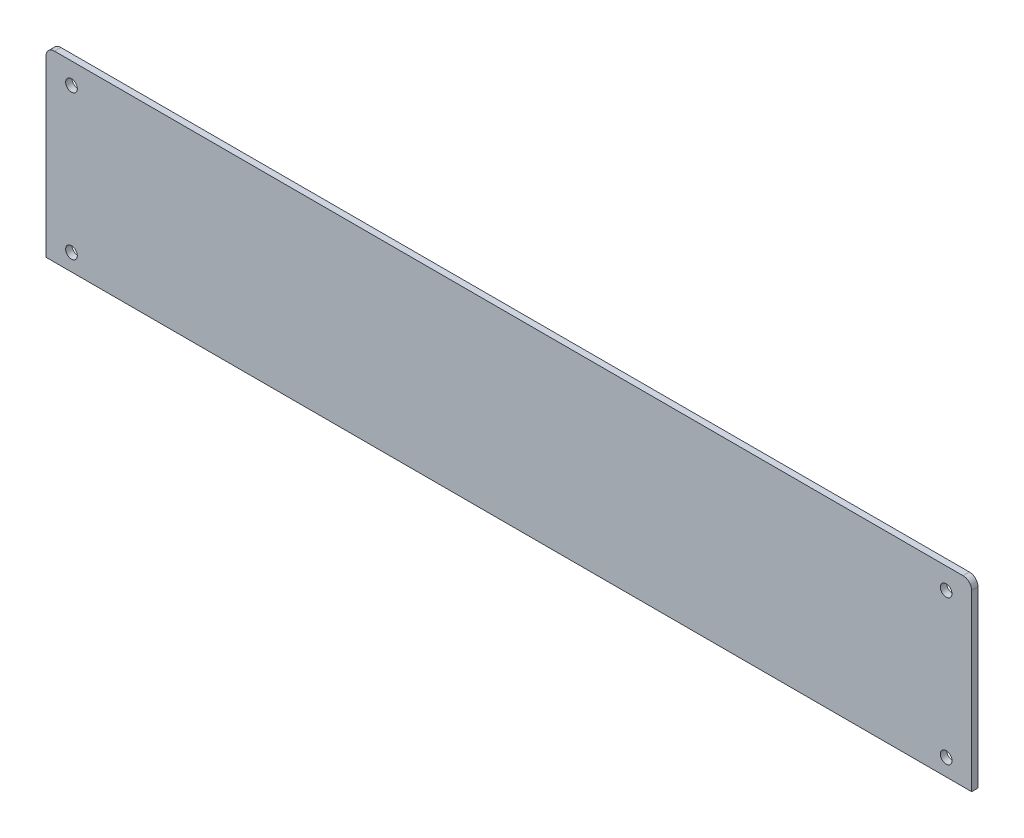
from build123d import *

# Parameters (mm, degrees)
SKETCH_1_W          = 436
SKETCH_1_H          = 86.1
EXTRUDE_1_DEPTH     = 3
SKETCH_6_R          = 2.75
CUT_EXTRUDE_1_DEPTH = 445.430208244
FILLET_1_R          = 4


with BuildPart() as part:
    # Эскиз1 → Бобышка-Вытянуть1 (new body)
    with BuildSketch(Plane.XY):
        with Locations((218, 43.05)):
            Rectangle(SKETCH_1_W, SKETCH_1_H)
    extrude(amount=EXTRUDE_1_DEPTH)

    # Эскиз6 → Вырез-Вытянуть1 (cut, through all)
    with BuildSketch(Plane(origin=(0, 0, 0), x_dir=(-1, 0, 0), z_dir=(0, 0, -1))):
        with Locations((-424, 76.1)):
            Circle(SKETCH_6_R)
        with Locations((-424, 8)):
            Circle(SKETCH_6_R)
        with Locations((-12, 8)):
            Circle(SKETCH_6_R)
        with Locations((-12, 76.1)):
            Circle(SKETCH_6_R)
    extrude(amount=-CUT_EXTRUDE_1_DEPTH, mode=Mode.SUBTRACT)

    # Скругление1
    fillet_1_edges = [part.edges().sort_by_distance(p)[0] for p in [
        (0, 86.1, 1.5),
        (436, 86.1, 1.5),
    ]]
    fillet(fillet_1_edges, radius=FILLET_1_R)


solid = part.part
